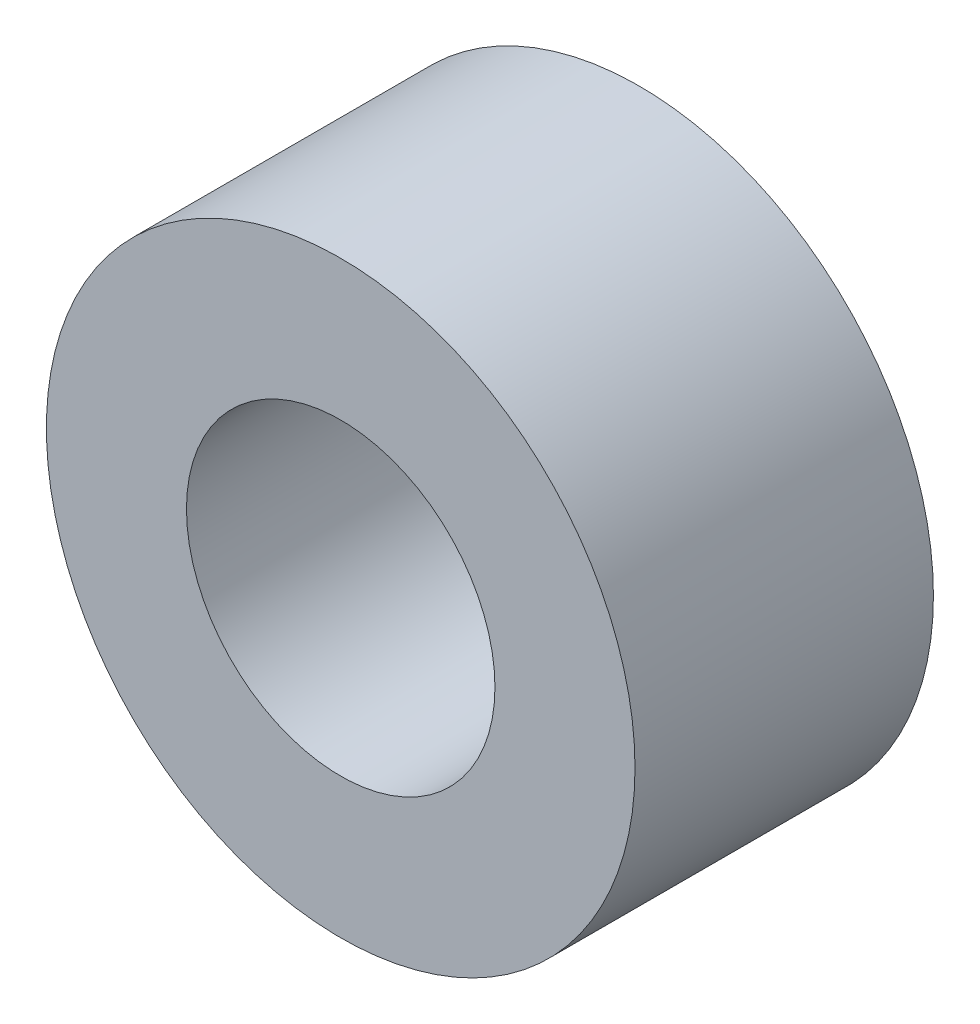
from build123d import *

# Parameters (mm, degrees)
ESQUISSE1_R        = 7.89
ESQUISSE1_R_2      = 4.135
BOSS_EXTRU_1_DEPTH = 8


with BuildPart() as part:
    # Esquisse1 → Boss.-Extru.1 (new body)
    with BuildSketch(Plane(origin=(0, 0, 0), x_dir=(0, 1, 0), z_dir=(0, 0, 1))):
        with Locations(Location((0, 0, 0), (0, 0, 270))):
            Circle(ESQUISSE1_R)
        with Locations(Location((0, 0, 0), (0, 0, 270))):
            Circle(ESQUISSE1_R_2, mode=Mode.SUBTRACT)
    extrude(amount=BOSS_EXTRU_1_DEPTH)


solid = part.part
